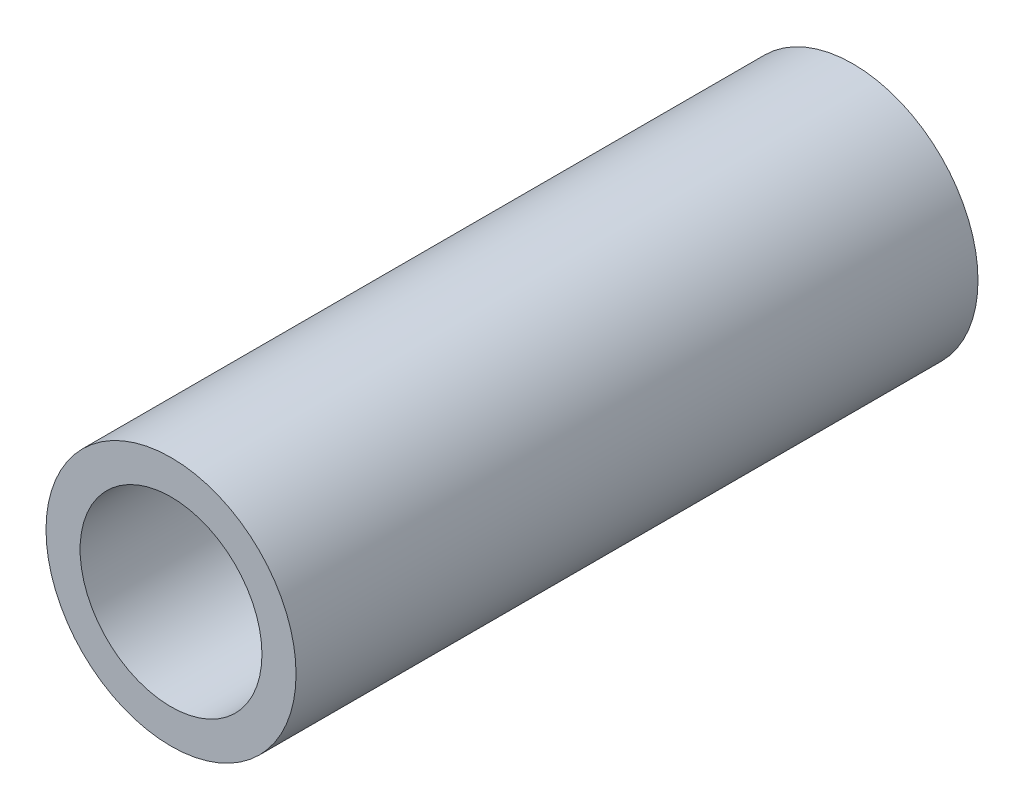
from build123d import *

# Parameters (mm, degrees)
CROQUIS1_R              = 5.5
SALIENTE_EXTRUIR1_DEPTH = 30
CROQUIS2_R              = 4
CORTAR_EXTRUIR1_DEPTH   = 30


with BuildPart() as part:
    # Croquis1 → Saliente-Extruir1 (new body)
    with BuildSketch(Plane.XY):
        Circle(CROQUIS1_R)
    extrude(amount=SALIENTE_EXTRUIR1_DEPTH)

    # Croquis2 → Cortar-Extruir1 (cut)
    with BuildSketch(Plane.XY.offset(30)):
        Circle(CROQUIS2_R)
    extrude(amount=-CORTAR_EXTRUIR1_DEPTH, mode=Mode.SUBTRACT)


solid = part.part
